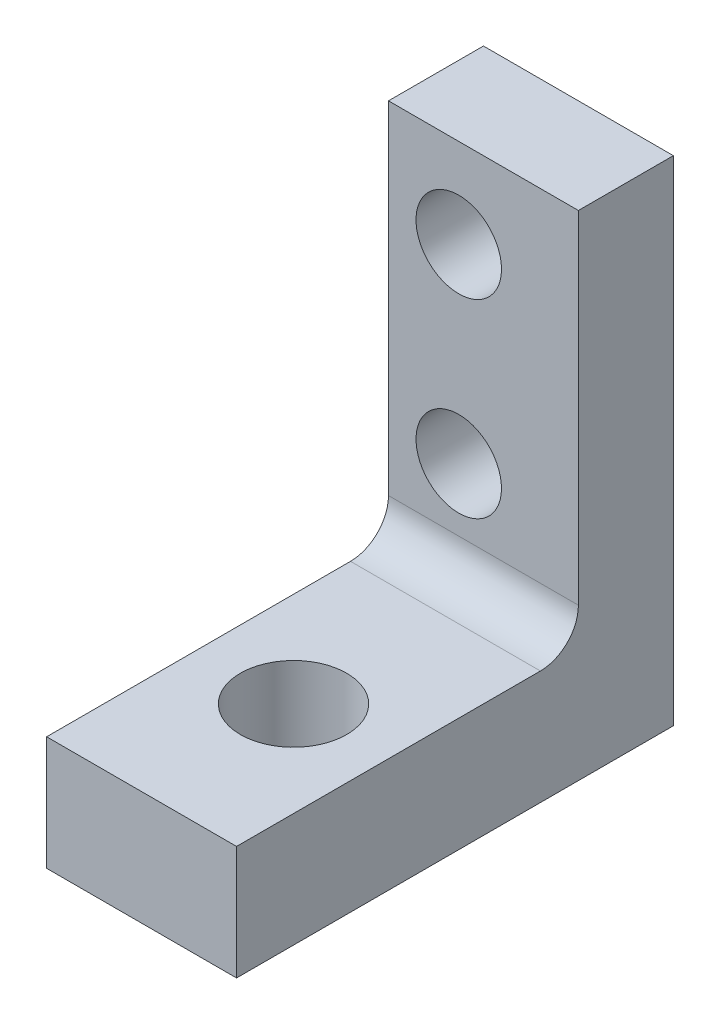
from build123d import *

# Parameters (mm, degrees)
SKETCH1_W           = 10
SKETCH1_H           = 23
SKETCH1_R           = 2.8
BOSS_EXTRUDE1_DEPTH = 6
SKETCH2_W           = 10
SKETCH2_H           = 5
BOSS_EXTRUDE2_DEPTH = 20
SKETCH4_R           = 2.25
CUT_EXTRUDE1_DEPTH  = 10
FILLET1_R           = 2


with BuildPart() as part:
    # Sketch1 → Boss-Extrude1 (new body)
    with BuildSketch(Plane(origin=(0, 0, 0), x_dir=(1, 0, 0), z_dir=(0, 1, 0))):
        with Locations((0, 3.5)):
            Rectangle(SKETCH1_W, SKETCH1_H)
        with Locations(Location((0, 0, 0), (0, 0, 270))):
            Circle(SKETCH1_R, mode=Mode.SUBTRACT)
    extrude(amount=BOSS_EXTRUDE1_DEPTH)

    # Sketch2 → Boss-Extrude2 (add)
    with BuildSketch(Plane(origin=(0, 6, 0), x_dir=(1, 0, 0), z_dir=(0, 1, 0))):
        with Locations((0, 12.5)):
            Rectangle(SKETCH2_W, SKETCH2_H)
    extrude(amount=BOSS_EXTRUDE2_DEPTH)

    # Sketch4 → Cut-Extrude1 (cut)
    with BuildSketch(Plane.XY.offset(-10)):
        with Locations((-1.3, 11.3)):
            Circle(SKETCH4_R)
        with Locations((-1.3, 21.3)):
            Circle(SKETCH4_R)
    extrude(amount=-CUT_EXTRUDE1_DEPTH, mode=Mode.SUBTRACT)

    # Fillet1
    fillet1_edges = [part.edges().sort_by_distance(p)[0] for p in [
        (0, 6, -10),
    ]]
    fillet(fillet1_edges, radius=FILLET1_R)


solid = part.part
